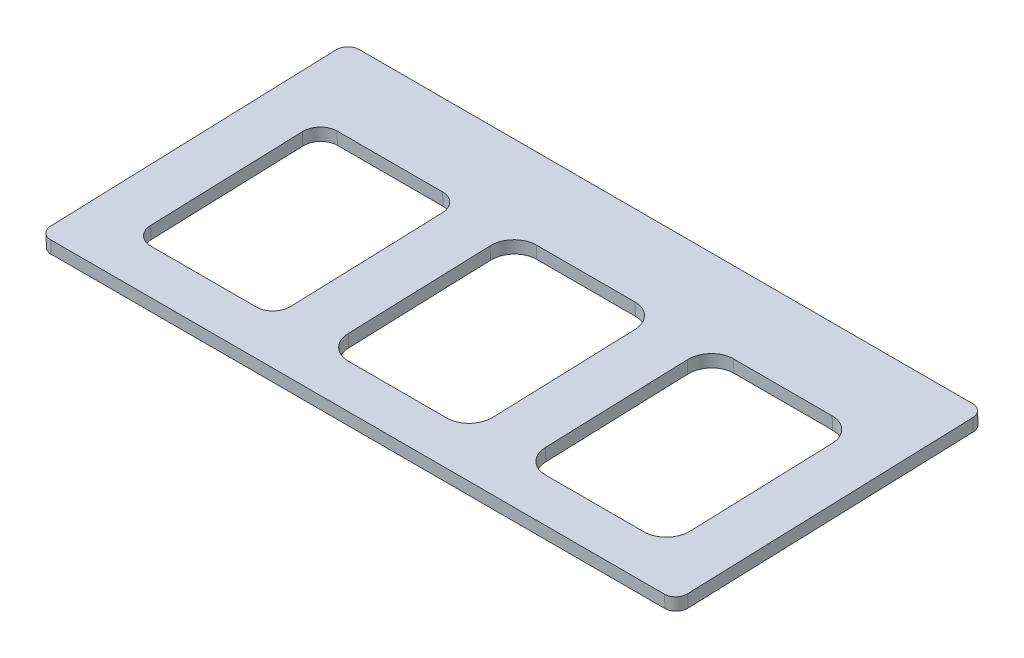
from build123d import *

# Parameters (mm, degrees)
BOSS_EXTRUDE1_DEPTH = 2.2


with BuildPart() as part:
    # Sketch1 → Boss-Extrude1 (new body)
    with BuildSketch(Plane(origin=(0, -71.98718802, -2.513847999), x_dir=(1, 0, 0), z_dir=(0, -0.9993908270190958, -0.034899496702501066))):
        with BuildLine():
            Line((-53.175, -49.240365792), (53.175, -49.240365792))
            ThreePointArc((53.175, -49.240365792), (54.589213562, -48.654579354), (55.175, -47.240365792))
            Line((55.175, -47.240365792), (55.175, 2.21159528))
            ThreePointArc((55.175, 2.21159528), (54.589213562, 3.625808843), (53.175, 4.21159528))
            Line((53.175, 4.21159528), (-53.175, 4.21159528))
            ThreePointArc((-53.175, 4.21159528), (-54.589213562, 3.625808843), (-55.175, 2.21159528))
            Line((-55.175, 2.21159528), (-55.175, -47.240365792))
            ThreePointArc((-55.175, -47.240365792), (-54.589213562, -48.654579354), (-53.175, -49.240365792))
        make_face()
        with BuildLine():
            Line((-22.025, -32.562401314), (-22.025, -6.262401314))
            ThreePointArc((-22.025, -6.262401314), (-22.903679656, -4.14108097), (-25.025, -3.262401314))
            Line((-25.025, -3.262401314), (-43.325, -3.262401314))
            ThreePointArc((-43.325, -3.262401314), (-45.446320344, -4.14108097), (-46.325, -6.262401314))
            Line((-46.325, -6.262401314), (-46.325, -32.562401314))
            ThreePointArc((-46.325, -32.562401314), (-45.446320344, -34.683721657), (-43.325, -35.562401314))
            Line((-43.325, -35.562401314), (-25.025, -35.562401314))
            ThreePointArc((-25.025, -35.562401314), (-22.903679656, -34.683721657), (-22.025, -32.562401314))
        make_face(mode=Mode.SUBTRACT)
        with BuildLine():
            Line((-8.95, -3.112401314), (8.15, -3.112401314))
            ThreePointArc((8.15, -3.112401314), (10.978427125, -4.283974189), (12.15, -7.112401314))
            Line((12.15, -7.112401314), (12.15, -31.712401314))
            ThreePointArc((12.15, -31.712401314), (10.978427125, -34.540828439), (8.15, -35.712401314))
            Line((8.15, -35.712401314), (-8.95, -35.712401314))
            ThreePointArc((-8.95, -35.712401314), (-11.778427125, -34.540828439), (-12.95, -31.712401314))
            Line((-12.95, -31.712401314), (-12.95, -7.112401314))
            ThreePointArc((-12.95, -7.112401314), (-11.778427125, -4.283974189), (-8.95, -3.112401314))
        make_face(mode=Mode.SUBTRACT)
        with BuildLine():
            Line((25.225, -3.112401314), (42.325, -3.112401314))
            ThreePointArc((42.325, -3.112401314), (45.153427125, -4.283974189), (46.325, -7.112401314))
            Line((46.325, -7.112401314), (46.325, -31.712401314))
            ThreePointArc((46.325, -31.712401314), (45.153427125, -34.540828439), (42.325, -35.712401314))
            Line((42.325, -35.712401314), (25.225, -35.712401314))
            ThreePointArc((25.225, -35.712401314), (22.396572875, -34.540828439), (21.225, -31.712401314))
            Line((21.225, -31.712401314), (21.225, -7.112401314))
            ThreePointArc((21.225, -7.112401314), (22.396572875, -4.283974189), (25.225, -3.112401314))
        make_face(mode=Mode.SUBTRACT)
    extrude(amount=-BOSS_EXTRUDE1_DEPTH)


solid = part.part
